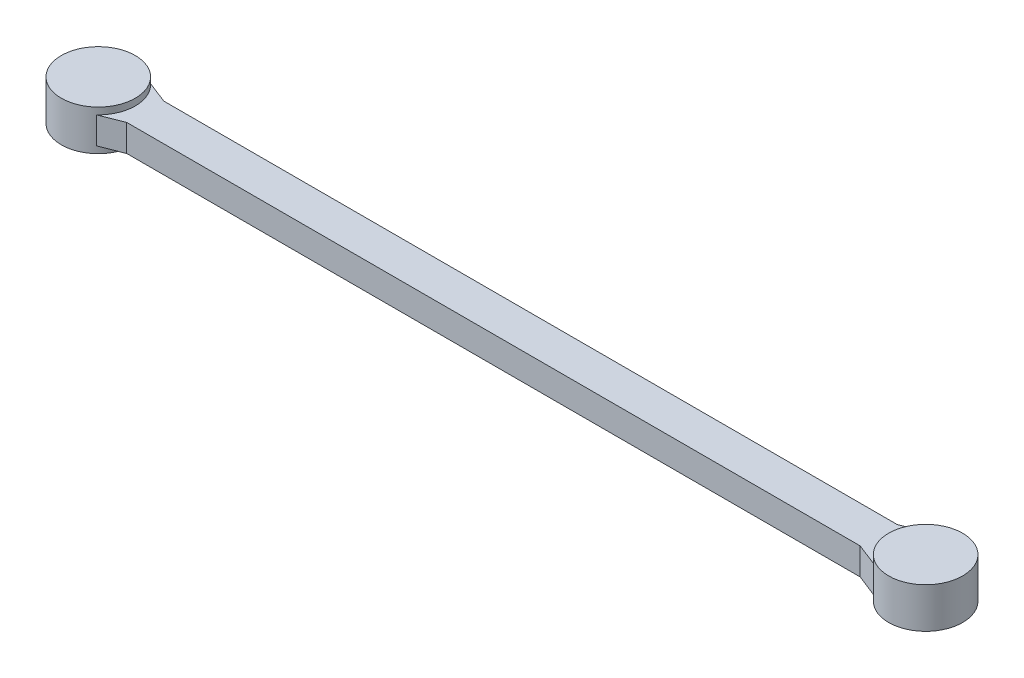
from build123d import *

# Parameters (mm, degrees)
BOSS_EXTRUDE1_DEPTH      = 40
BOSS_EXTRUDE2_DEPTH      = 10
BOSS_EXTRUDE2_DEPTH_BACK = 50
SKETCH3_R                = 55


with BuildPart() as part:
    # Sketch2 → Boss-Extrude1 (new body)
    with BuildSketch(Plane(origin=(0, 0, 0), x_dir=(1, 0, 0), z_dir=(0, 1, 0))):
        Polygon((-545, 0), (545, 0), (614.776428685, 27.5), (614.776428685, -82.5), (545, -55), (-545, -55), (-614.776428685, -82.5), (-614.776428685, 27.5), align=None)
    extrude(amount=BOSS_EXTRUDE1_DEPTH)

    # Sketch3 → Boss-Extrude2 (add, two sides: drawn at the far end of the back side and taken through both)
    with BuildSketch(Plane(origin=(0, 40, 0), x_dir=(1, 0, 0), z_dir=(0, 1, 0)).offset(-BOSS_EXTRUDE2_DEPTH_BACK)):
        with Locations(Location((-614.776428685, -27.5, 0), (0, 0, 270))):
            Circle(SKETCH3_R)
        with Locations(Location((614.776428685, -27.5, 0), (0, 0, 270))):
            Circle(SKETCH3_R)
    extrude(amount=BOSS_EXTRUDE2_DEPTH + BOSS_EXTRUDE2_DEPTH_BACK)


solid = part.part
